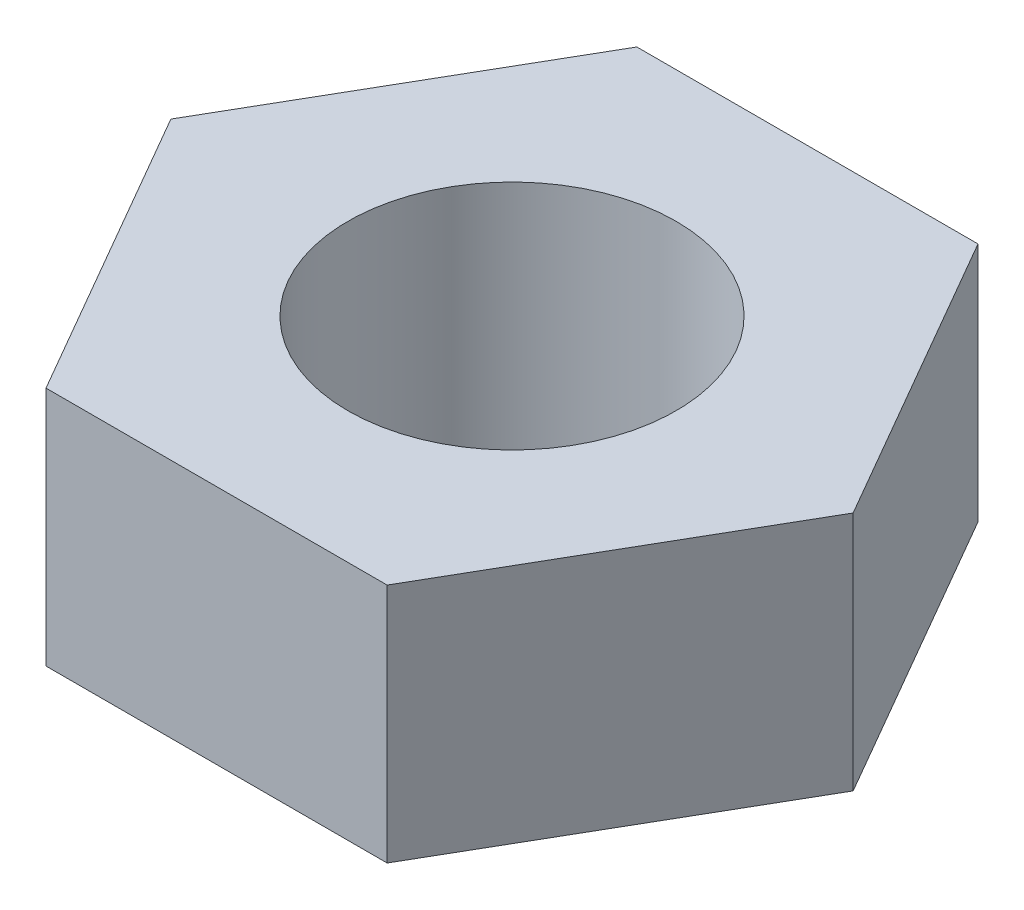
from build123d import *

# Parameters (mm, degrees)
CROQUIS1_R              = 1.5
SALIENTE_EXTRUIR1_DEPTH = 2.2


with BuildPart() as part:
    # Croquis1 → Saliente-Extruir1 (new body)
    with BuildSketch(Plane(origin=(0, 0, 0), x_dir=(1, 0, 0), z_dir=(0, 1, 0))):
        Polygon((3.117691454, 0), (1.558845727, 2.7), (-1.558845727, 2.7), (-3.117691454, 0), (-1.558845727, -2.7), (1.558845727, -2.7), align=None)
        with Locations(Location((0, 0, 0), (0, 0, 270))):
            Circle(CROQUIS1_R, mode=Mode.SUBTRACT)
    extrude(amount=SALIENTE_EXTRUIR1_DEPTH)


solid = part.part
